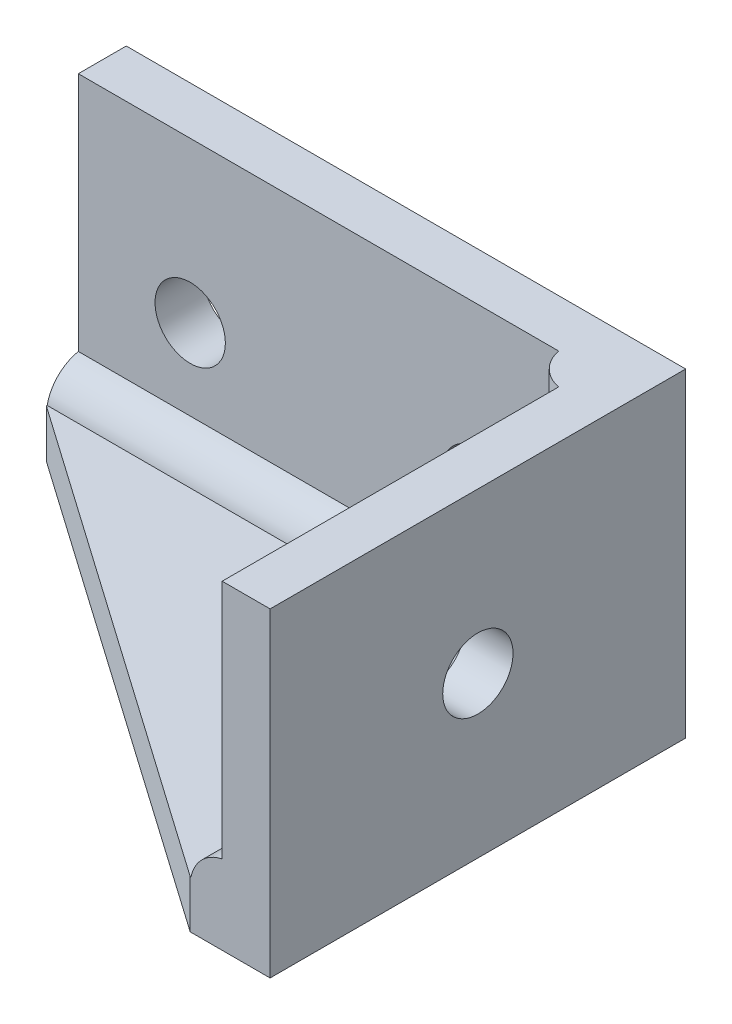
from build123d import *

# Parameters (mm, degrees)
BOSS_EXTRUDE1_DEPTH      = 20
CUT_EXTRUDE1_DEPTH       = 17
SKETCH3_R                = 2.5
BOSS_EXTRUDE2_DEPTH      = 23
BOSS_EXTRUDE3_REACH      = 49.969
BOSS_EXTRUDE3_END_RADIUS = 2.5
SKETCH4_R                = 2.5
BOSS_EXTRUDE4_REACH      = 49.969
SKETCH5_R                = 2.5
SKETCH6_R                = 2.2
CUT_EXTRUDE2_DEPTH       = 47.411205543
SKETCH7_R                = 2.2
CUT_EXTRUDE3_DEPTH       = 46.82575695


with BuildPart() as part:
    # Sketch1 → Boss-Extrude1 (new body)
    with BuildSketch(Plane(origin=(0, 0, 0), x_dir=(1, 0, 0), z_dir=(0, 1, 0))):
        Polygon((0, 0), (-35, 0), (-35, -5), (-5, -26), (0, -26), align=None)
    extrude(amount=BOSS_EXTRUDE1_DEPTH)

    # Sketch2 → Cut-Extrude1 (cut)
    with BuildSketch(Plane(origin=(0, 20, 0), x_dir=(1, 0, 0), z_dir=(0, 1, 0))):
        Polygon((-35, -3), (-3, -3), (-3, -26), (-5, -26), (-35, -5), align=None)
    extrude(amount=-CUT_EXTRUDE1_DEPTH, mode=Mode.SUBTRACT)

    # Sketch3 → Boss-Extrude2 (add)
    with BuildSketch(Plane.XY.offset(26)):
        with Locations((-2.5, 2.5)):
            Circle(SKETCH3_R)
    extrude(amount=-BOSS_EXTRUDE2_DEPTH)

    # Boss-Extrude3: up to this cylinder (the profile starts outside it)
    boss_extrude3_end = Plane(origin=(-2.5, 2.5, 2.5), z_dir=(0, 0, 1)) * Cylinder(BOSS_EXTRUDE3_END_RADIUS, 105.938, mode=Mode.PRIVATE)
    # Sketch4 → Boss-Extrude3 (add, up to the surface)
    with BuildSketch(Plane.ZY.offset(35), mode=Mode.PRIVATE) as boss_extrude3_sk1:
        with Locations((2.5, 2.5)):
            Circle(SKETCH4_R)
    boss_extrude3_tool1 = extrude(boss_extrude3_sk1.sketch, amount=-BOSS_EXTRUDE3_REACH, mode=Mode.PRIVATE) - boss_extrude3_end
    add(boss_extrude3_tool1.solids().sort_by_distance((-35, 2.5, 2.5))[0])

    # Sketch5 → Boss-Extrude4 (add, up to next)
    with BuildSketch(Plane(origin=(0, 20, 0), x_dir=(1, 0, 0), z_dir=(0, 1, 0)), mode=Mode.PRIVATE) as boss_extrude4_sk1:
        with Locations((-2.5, -2.5)):
            Circle(SKETCH5_R)
    boss_extrude4_tool1 = extrude(boss_extrude4_sk1.sketch, amount=-BOSS_EXTRUDE4_REACH, mode=Mode.PRIVATE) - part.part
    add(boss_extrude4_tool1.solids().sort_by_distance((-2.5, 20, 2.5))[0])

    # Sketch6 → Cut-Extrude2 (cut, through all)
    with BuildSketch(Plane.XY.offset(3)):
        with Locations((-28, 10)):
            Circle(SKETCH6_R)
        with Locations((-10, 10)):
            Circle(SKETCH6_R)
    extrude(amount=-CUT_EXTRUDE2_DEPTH, mode=Mode.SUBTRACT)

    # Sketch7 → Cut-Extrude3 (cut, through all)
    with BuildSketch(Plane.ZY.offset(3)):
        with Locations((13, 10)):
            Circle(SKETCH7_R)
    extrude(amount=-CUT_EXTRUDE3_DEPTH, mode=Mode.SUBTRACT)


solid = part.part
